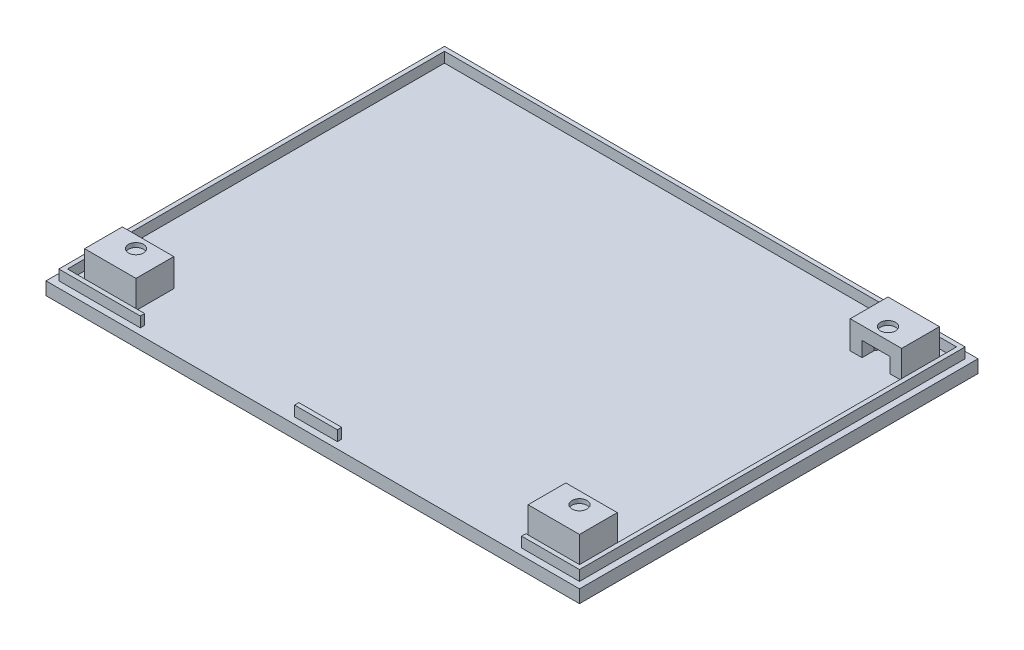
from build123d import *

# Parameters (mm, degrees)
SKETCH_1_W          = 124.5
SKETCH_1_H          = 93
EXTRUDE_1_DEPTH     = 3
SKETCH_2_W          = 10
SKETCH_2_H          = 1
EXTRUDE_1_2_DEPTH   = 2.4
EXTRUDE_2_DEPTH     = 3.5
SKETCH_4_W          = 12
SKETCH_4_H          = 8.814582562
EXTRUDE_3_DEPTH     = 3
SKETCH_5_R          = 1.75
CUT_EXTRUDE_1_DEPTH = 1


with BuildPart() as part:
    # Эскиз1 → Extrude 1 (new body)
    with BuildSketch(Plane(origin=(0, 0, 0), x_dir=(1, 0, 0), z_dir=(0, 1, 0))):
        Rectangle(SKETCH_1_W, SKETCH_1_H)
    extrude(amount=EXTRUDE_1_DEPTH)

    # Эскиз2 → Extrude 1 2 (add)
    with BuildSketch(Plane(origin=(0, 3, 0), x_dir=(1, 0, 0), z_dir=(0, 1, 0))):
        Polygon((-41.75, -44), (-59.75, -44), (-59.75, 44), (59.75, 44), (59.75, -44), (47.25, -44), (47.25, -45), (60.75, -45), (60.75, 45), (-60.75, 45), (-60.75, -45), (-41.75, -45), align=None)
        with Locations((-0.75, -44.5)):
            Rectangle(SKETCH_2_W, SKETCH_2_H)
    extrude(amount=EXTRUDE_1_2_DEPTH)

    # Эскиз3 → Бобышка-Вытянуть2 (add)
    with BuildSketch(Plane(origin=(0, 3, 0), x_dir=(1, 0, 0), z_dir=(0, 1, 0))):
        Polygon((-55, -36), (-55, -33.185417438), (-57.75, -33.185417438), (-57.75, -42), (-45.75, -42), (-45.75, -33.185417438), (-48.5, -33.185417438), (-48.5, -36), (-50.125, -38.814582562), (-53.375, -38.814582562), align=None)
        Polygon((55, 36), (55, 33.185417438), (57.75, 33.185417438), (57.75, 42), (45.75, 42), (45.75, 33.185417438), (48.5, 33.185417438), (48.5, 36), (50.125, 38.814582562), (53.375, 38.814582562), align=None)
        Polygon((55, -36), (55, -33.185417438), (57.75, -33.185417438), (57.75, -42), (45.75, -42), (45.75, -33.185417438), (48.5, -33.185417438), (48.5, -36), (50.125, -38.814582562), (53.375, -38.814582562), align=None)
    extrude(amount=EXTRUDE_2_DEPTH)

    # Эскиз4 → Бобышка-Вытянуть3 (add)
    with BuildSketch(Plane(origin=(0, 6.5, 0), x_dir=(1, 0, 0), z_dir=(0, 1, 0))):
        with Locations((-51.75, -37.592708719)):
            Rectangle(SKETCH_4_W, SKETCH_4_H)
        with Locations((51.75, -37.592708719)):
            Rectangle(SKETCH_4_W, SKETCH_4_H)
        with Locations((51.75, 37.592708719)):
            Rectangle(SKETCH_4_W, SKETCH_4_H)
    extrude(amount=EXTRUDE_3_DEPTH)

    # Эскиз5 → Вырез-Вытянуть1 (cut)
    with BuildSketch(Plane(origin=(0, 9.5, 0), x_dir=(1, 0, 0), z_dir=(0, 1, 0))):
        with Locations(Location((-51.75, -36, 0), (0, 0, 270))):
            Circle(SKETCH_5_R)
        with Locations(Location((51.75, -36, 0), (0, 0, 270))):
            Circle(SKETCH_5_R)
        with Locations(Location((51.75, 36, 0), (0, 0, 270))):
            Circle(SKETCH_5_R)
    extrude(amount=-CUT_EXTRUDE_1_DEPTH, mode=Mode.SUBTRACT)


solid = part.part
